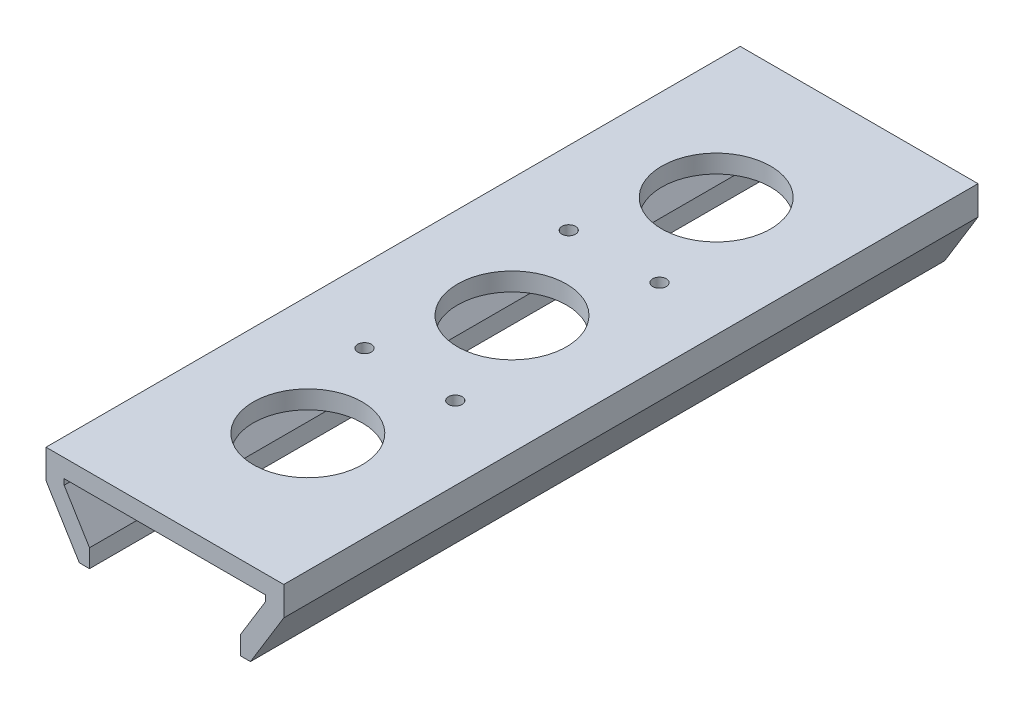
from build123d import *

# Parameters (mm, degrees)
BOSS_EXTRUDE1_DEPTH = 153
SKETCH2_R           = 12
CUT_EXTRUDE1_DEPTH  = 213
SKETCH3_R           = 1.5
CUT_EXTRUDE2_DEPTH  = 10


with BuildPart() as part:
    # Sketch1 → Boss-Extrude1 (new body)
    with BuildSketch(Plane.XY):
        Polygon((0, -13.289354466), (-22.2, -13.289354466), (-22.2, -14.545627613), (-16.612166923, -23.689354466), (-16.612166923, -27.689354466), (-18.855505392, -27.689354466), (-26.2, -15.671090562), (-26.2, -9.289354466), (26.2, -9.289354466), (26.2, -15.671090562), (18.855505392, -27.689354466), (16.612166923, -27.689354466), (16.612166923, -23.689354466), (22.2, -14.545627613), (22.2, -13.289354466), align=None)
    extrude(amount=BOSS_EXTRUDE1_DEPTH)

    # Sketch2 → Cut-Extrude1 (cut)
    with BuildSketch(Plane(origin=(0, -9.289354466, 0), x_dir=(1, 0, 0), z_dir=(0, 1, 0))):
        with Locations(Location((0, -31.5, 0), (0, 0, 180))):
            Circle(SKETCH2_R)
        with Locations(Location((0, -76.5, 0), (0, 0, 180))):
            Circle(SKETCH2_R)
        with Locations(Location((0, -121.5, 0), (0, 0, 180))):
            Circle(SKETCH2_R)
    extrude(amount=-CUT_EXTRUDE1_DEPTH, mode=Mode.SUBTRACT)

    # Sketch3 → Cut-Extrude2 (cut)
    with BuildSketch(Plane(origin=(0, -9.289354466, 0), x_dir=(1, 0, 0), z_dir=(0, 1, 0))):
        with Locations(Location((-10, -99, 0), (0, 0, 180))):
            Circle(SKETCH3_R)
        with Locations((10, -99)):
            Circle(SKETCH3_R)
        with Locations(Location((10, -54, 0), (0, 0, 180))):
            Circle(SKETCH3_R)
        with Locations((-10, -54)):
            Circle(SKETCH3_R)
    extrude(amount=-CUT_EXTRUDE2_DEPTH, mode=Mode.SUBTRACT)


solid = part.part
